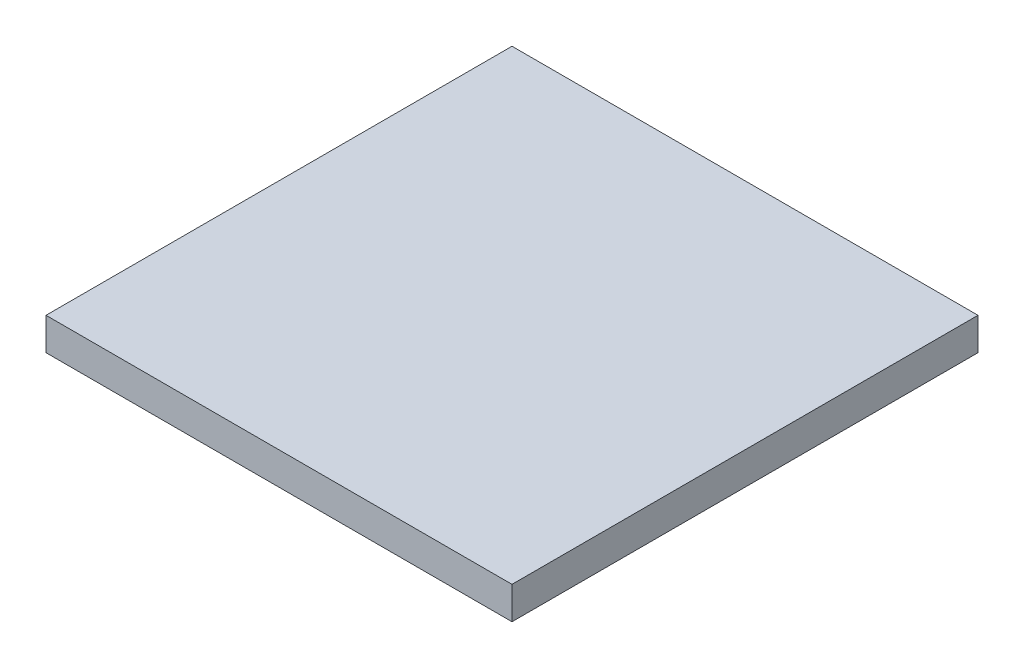
from build123d import *

# Parameters (mm, degrees)
SKETCH1_W           = 23
SKETCH1_H           = 23
PLATE_EXTRUDE_DEPTH = 1.6


with BuildPart() as part:
    # Sketch1 → Plate_Extrude (new body)
    with BuildSketch(Plane(origin=(0, 0, 0), x_dir=(1, 0, 0), z_dir=(0, 1, 0))):
        Rectangle(SKETCH1_W, SKETCH1_H)
    extrude(amount=PLATE_EXTRUDE_DEPTH)


solid = part.part
